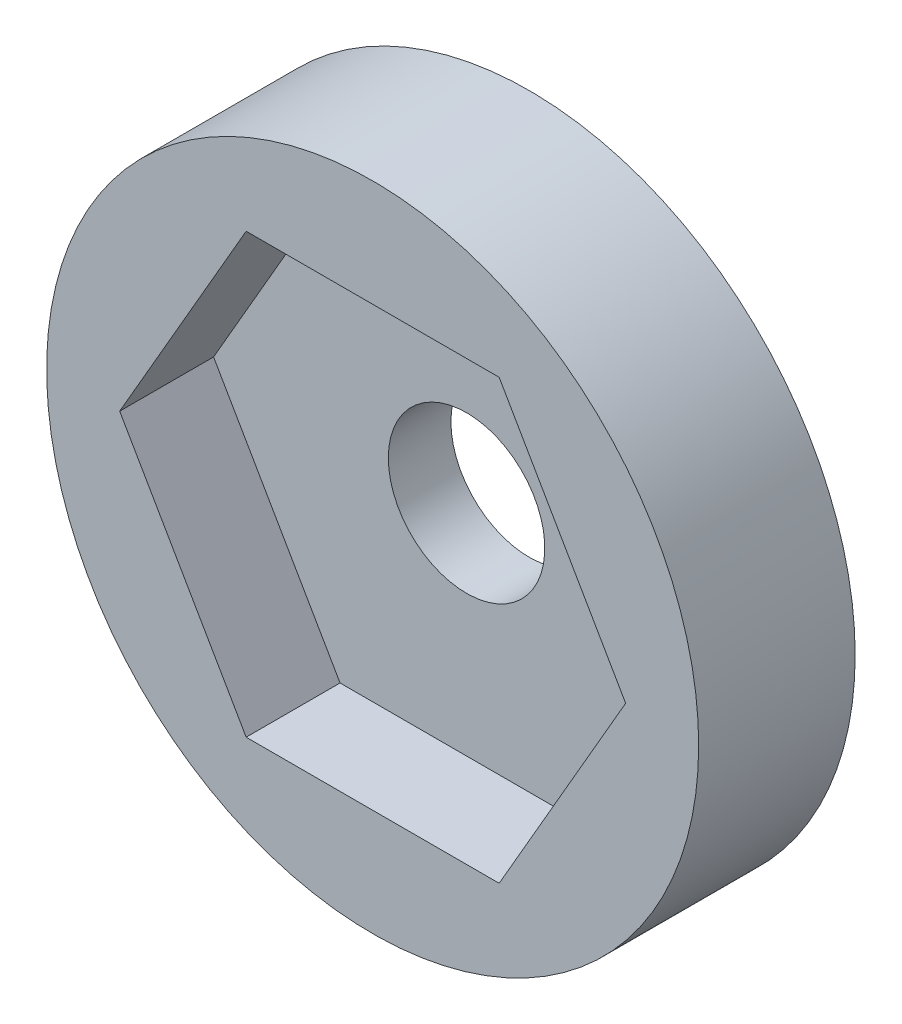
from build123d import *

# Parameters (mm, degrees)
SKETCH_1_R          = 12.5
EXTRUDE_1_DEPTH     = 6
CUT_EXTRUDE_1_DEPTH = 3.6
SKETCH_3_R          = 3
CUT_EXTRUDE_2_DEPTH = 2.4


with BuildPart() as part:
    # 草图1 → 凸台-拉伸1 (new body)
    with BuildSketch(Plane.XY):
        Circle(SKETCH_1_R)
    extrude(amount=EXTRUDE_1_DEPTH)

    # 草图2 → 切除-拉伸1 (cut)
    with BuildSketch(Plane.XY.offset(6)):
        Polygon((9.699484522, 0), (4.849742261, 8.4), (-4.849742261, 8.4), (-9.699484522, 0), (-4.849742261, -8.4), (4.849742261, -8.4), align=None)
    extrude(amount=-CUT_EXTRUDE_1_DEPTH, mode=Mode.SUBTRACT)

    # 草图3 → 切除-拉伸2 (cut)
    with BuildSketch(Plane(origin=(0, 0, 0), x_dir=(-1, 0, 0), z_dir=(0, 0, -1))):
        Circle(SKETCH_3_R)
    extrude(amount=-CUT_EXTRUDE_2_DEPTH, mode=Mode.SUBTRACT)


solid = part.part
